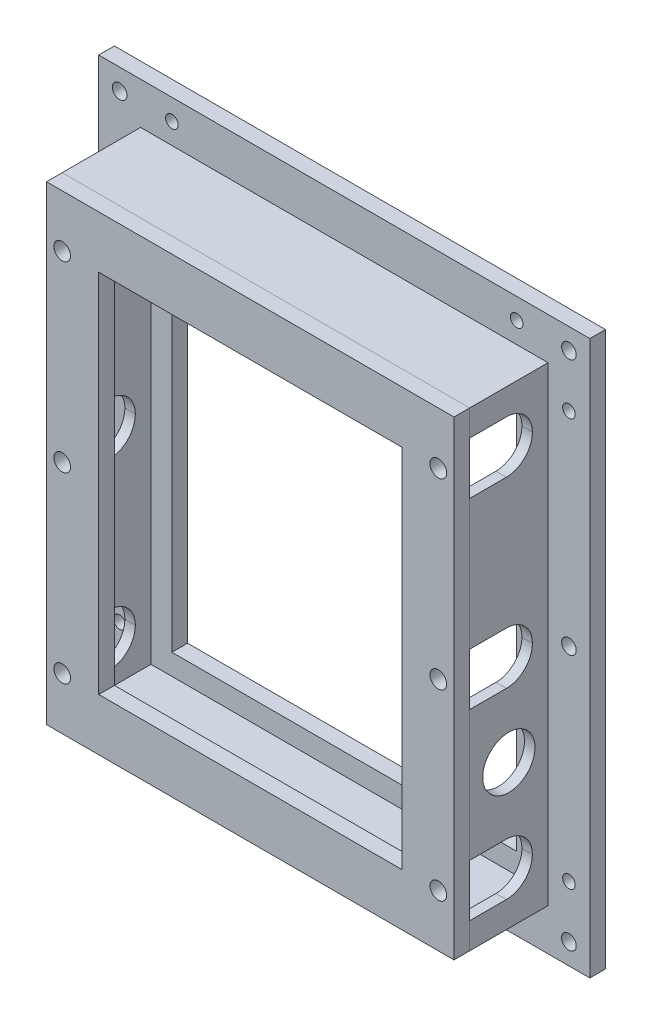
from build123d import *

# Parameters (mm, degrees)
SKETCH_1_W          = 390
SKETCH_1_H          = 450
EXTRUDE_1_DEPTH     = 15
SKETCH_2_W          = 390
SKETCH_2_H          = 450
SKETCH_2_W_2        = 370
SKETCH_2_H_2        = 430
EXTRUDE_2_DEPTH     = 75
SKETCH_3_W          = 290
SKETCH_3_H          = 350
CUT_EXTRUDE_1_DEPTH = 75
SKETCH_4_W          = 470
SKETCH_4_H          = 530
SKETCH_4_W_2        = 330
SKETCH_4_H_2        = 390
EXTRUDE_3_DEPTH     = 15
SKETCH_5_R          = 8
CUT_EXTRUDE_2_DEPTH = 30
SKETCH_6_W          = 60
SKETCH_6_H          = 50
CUT_EXTRUDE_3_DEPTH = 659.103335351
FILLET_1_R          = 24.9
FILLET_2_R          = 24.9
SKETCH_7_R          = 7
SKETCH_7_R_2        = 6
CUT_EXTRUDE_4_DEPTH = 30
SKETCH_9_R          = 25
CUT_EXTRUDE_6_DEPTH = 30


with BuildPart() as part:
    # 草图1 → 拉伸1 (new body)
    with BuildSketch(Plane.XY):
        with Locations((195, -225)):
            Rectangle(SKETCH_1_W, SKETCH_1_H)
    extrude(amount=EXTRUDE_1_DEPTH)

    # 草图3 → 切除-拉伸1 (cut)
    with BuildSketch(Plane.XY.offset(15)):
        with Locations((195, -225)):
            Rectangle(SKETCH_3_W, SKETCH_3_H)
    extrude(amount=-CUT_EXTRUDE_1_DEPTH, mode=Mode.SUBTRACT)


with BuildPart() as body_2:
    # 草图2 → 拉伸2 (new body)
    with BuildSketch(Plane(origin=(0, 0, 0), x_dir=(-1, 0, 0), z_dir=(0, 0, -1))):
        with Locations((-195, -225)):
            Rectangle(SKETCH_2_W, SKETCH_2_H)
        with Locations((-195, -225)):
            Rectangle(SKETCH_2_W_2, SKETCH_2_H_2, mode=Mode.SUBTRACT)
    extrude(amount=EXTRUDE_2_DEPTH)

    # 草图4 → 拉伸3 (add)
    with BuildSketch(Plane(origin=(0, 0, -75), x_dir=(-1, 0, 0), z_dir=(0, 0, -1))):
        with Locations((-195, -225)):
            Rectangle(SKETCH_4_W, SKETCH_4_H)
        with Locations((-195, -225)):
            Rectangle(SKETCH_4_W_2, SKETCH_4_H_2, mode=Mode.SUBTRACT)
    extrude(amount=EXTRUDE_3_DEPTH)


with BuildPart() as cut_extrude_2_tool:
    # 草图5 → 切除-拉伸2 (new body)
    with BuildSketch(Plane.XY.offset(15)):
        with Locations((15, -50)):
            Circle(SKETCH_5_R)
        with Locations((375, -50)):
            Circle(SKETCH_5_R)
        with Locations((15, -225)):
            Circle(SKETCH_5_R)
        with Locations((375, -225)):
            Circle(SKETCH_5_R)
        with Locations((15, -400)):
            Circle(SKETCH_5_R)
        with Locations((375, -400)):
            Circle(SKETCH_5_R)
    extrude(amount=-CUT_EXTRUDE_2_DEPTH)


with BuildPart() as part_1:
    add(part.part)

    # 切除-拉伸2: cut by cut_extrude_2_tool
    add(cut_extrude_2_tool.part, mode=Mode.SUBTRACT)


with BuildPart() as body_2_1:
    add(body_2.part)

    # 切除-拉伸2: cut by cut_extrude_2_tool
    add(cut_extrude_2_tool.part, mode=Mode.SUBTRACT)

    # 草图6 → 切除-拉伸3 (cut, through all)
    with BuildSketch(Plane.ZY):
        with Locations((-30, -50)):
            Rectangle(SKETCH_6_W, SKETCH_6_H)
        with Locations((-30, -225)):
            Rectangle(SKETCH_6_W, SKETCH_6_H)
        with Locations((-30, -400)):
            Rectangle(SKETCH_6_W, SKETCH_6_H)
    extrude(amount=-CUT_EXTRUDE_3_DEPTH, mode=Mode.SUBTRACT)

    # 圆角1
    fillet_1_edges = [body_2_1.edges().sort_by_distance(p)[0] for p in [
        (5, -75, -60),
        (5, -25, -60),
        (5, -250, -60),
        (5, -200, -60),
        (5, -425, -60),
        (5, -375, -60),
    ]]
    fillet(fillet_1_edges, radius=FILLET_1_R)

    # 圆角2
    fillet_2_edges = [body_2_1.edges().sort_by_distance(p)[0] for p in [
        (385, -75, -60),
        (385, -25, -60),
        (385, -250, -60),
        (385, -200, -60),
        (385, -425, -60),
        (385, -375, -60),
    ]]
    fillet(fillet_2_edges, radius=FILLET_2_R)

    # 草图7 → 切除-拉伸4 (cut)
    with BuildSketch(Plane.XY.offset(-75)):
        with Locations((-20, 20)):
            Circle(SKETCH_7_R)
        with Locations(Location((410, -420, 0), (0, 0, 180))):
            Circle(SKETCH_7_R_2)
        with Locations((30, 20)):
            Circle(SKETCH_7_R_2)
        with Locations((360, 20)):
            Circle(SKETCH_7_R_2)
        with Locations((-20, -30)):
            Circle(SKETCH_7_R_2)
        with Locations((410, 20)):
            Circle(SKETCH_7_R)
        with Locations((-20, -420)):
            Circle(SKETCH_7_R_2)
        with Locations(Location((410, -30, 0), (0, 0, 180))):
            Circle(SKETCH_7_R_2)
        with Locations((-20, -225)):
            Circle(SKETCH_7_R)
        with Locations((410, -225)):
            Circle(SKETCH_7_R)
        with Locations((-20, -470)):
            Circle(SKETCH_7_R)
        with Locations((30, -470)):
            Circle(SKETCH_7_R_2)
        with Locations((360, -470)):
            Circle(SKETCH_7_R_2)
        with Locations((410, -470)):
            Circle(SKETCH_7_R)
    extrude(amount=-CUT_EXTRUDE_4_DEPTH, mode=Mode.SUBTRACT)

    # 草图9 → 切除-拉伸6 (cut)
    with BuildSketch(Plane(origin=(390, 0, 0), x_dir=(0, 0, -1), z_dir=(1, 0, 0))):
        with Locations((37.5, -312.5)):
            Circle(SKETCH_9_R)
    extrude(amount=-CUT_EXTRUDE_6_DEPTH, mode=Mode.SUBTRACT)


solid = Compound([part_1.part, body_2_1.part])
